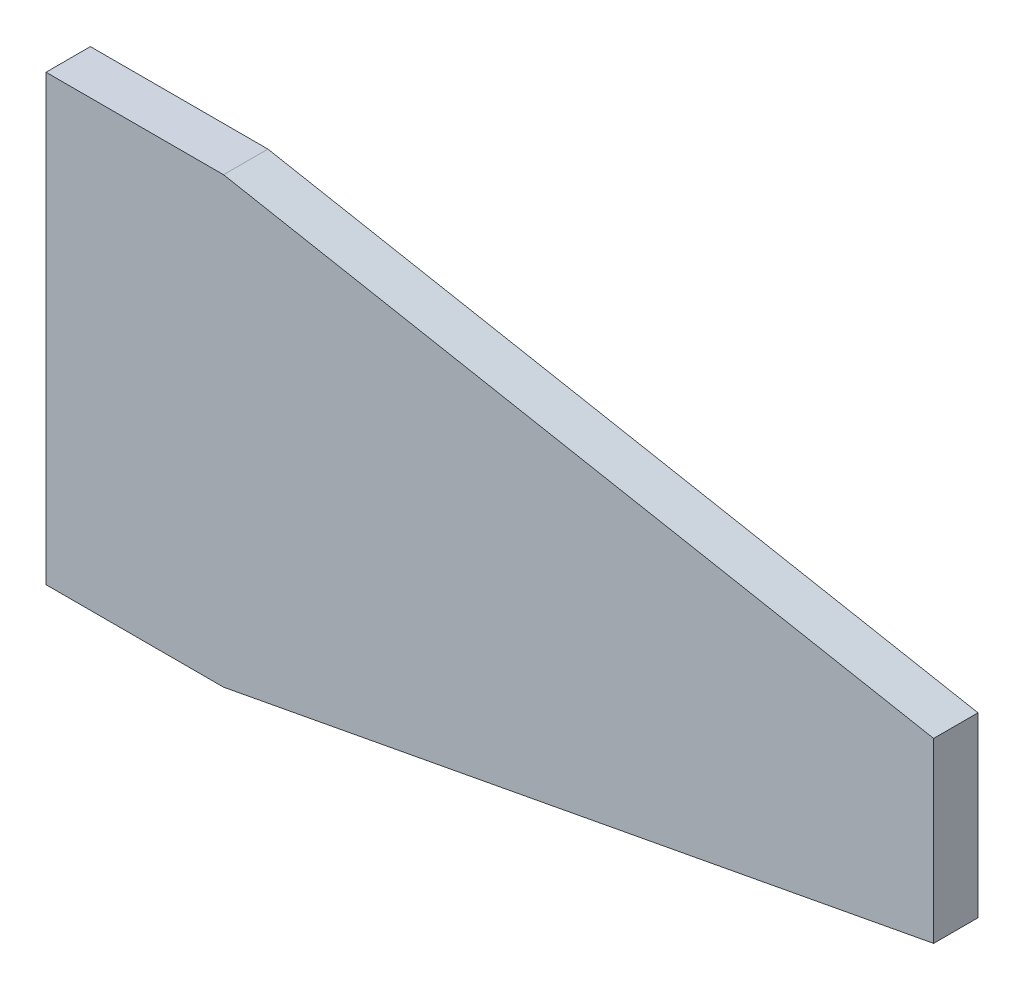
from build123d import *

# Parameters (mm, degrees)
BOSS_EXTRUDE1_DEPTH = 5


with BuildPart() as part:
    # Sketch1 → Boss-Extrude1 (new, symmetric)
    with BuildSketch(Plane.XY):
        Polygon((200, 20), (40, 50), (0, 50), (0, -50), (40, -50), (200, -20), align=None)
    extrude(amount=BOSS_EXTRUDE1_DEPTH, both=True)


solid = part.part
